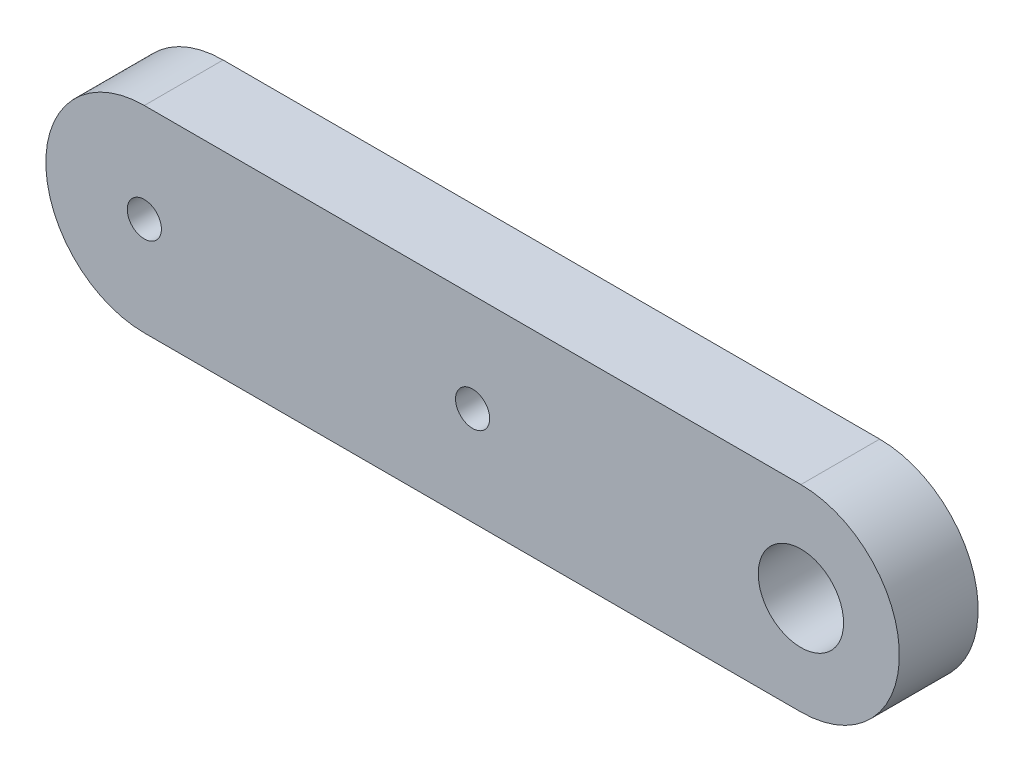
from build123d import *

# Parameters (mm, degrees)
SKETCH1_R           = 7.5
BOSS_EXTRUDE1_DEPTH = 6
SKETCH2_R           = 1.3
CUT_EXTRUDE1_DEPTH  = 59.296655136
LPATTERN1_COUNT     = 4
LPATTERN1_PITCH     = 25
SKETCH3_R           = 3.25
CUT_EXTRUDE2_DEPTH  = 59.296655136


with BuildPart() as part:
    # Sketch1 → Boss-Extrude1 (new body)
    with BuildSketch(Plane.XY):
        with BuildLine():
            Line((50, 7.5), (0, 7.5))
            ThreePointArc((0, 7.5), (5.303300859, 5.303300859), (7.5, 0))
            ThreePointArc((7.5, 0), (5.303300859, -5.303300859), (0, -7.5))
            Line((0, -7.5), (50, -7.5))
            ThreePointArc((50, -7.5), (42.5, 0), (50, 7.5))
        make_face()
        with Locations((50, 0)):
            Circle(SKETCH1_R)
        Circle(SKETCH1_R)
    extrude(amount=BOSS_EXTRUDE1_DEPTH)

    # Sketch2 → Cut-Extrude1 (cut, through all)
    with BuildSketch(Plane.XY.offset(6)):
        Circle(SKETCH2_R)
        with Locations((50, 0)):
            Circle(SKETCH2_R)
    cut_extrude1 = extrude(amount=-CUT_EXTRUDE1_DEPTH, mode=Mode.SUBTRACT)

    # LPattern1: Cut-Extrude1 ×4
    with Locations(*[(i * LPATTERN1_PITCH, 0, 0) for i in range(1, LPATTERN1_COUNT)]):
        add(cut_extrude1, mode=Mode.SUBTRACT)

    # Sketch3 → Cut-Extrude2 (cut, through all)
    with BuildSketch(Plane.XY.offset(6)):
        with Locations((50, 0)):
            Circle(SKETCH3_R)
    extrude(amount=-CUT_EXTRUDE2_DEPTH, mode=Mode.SUBTRACT)


solid = part.part
